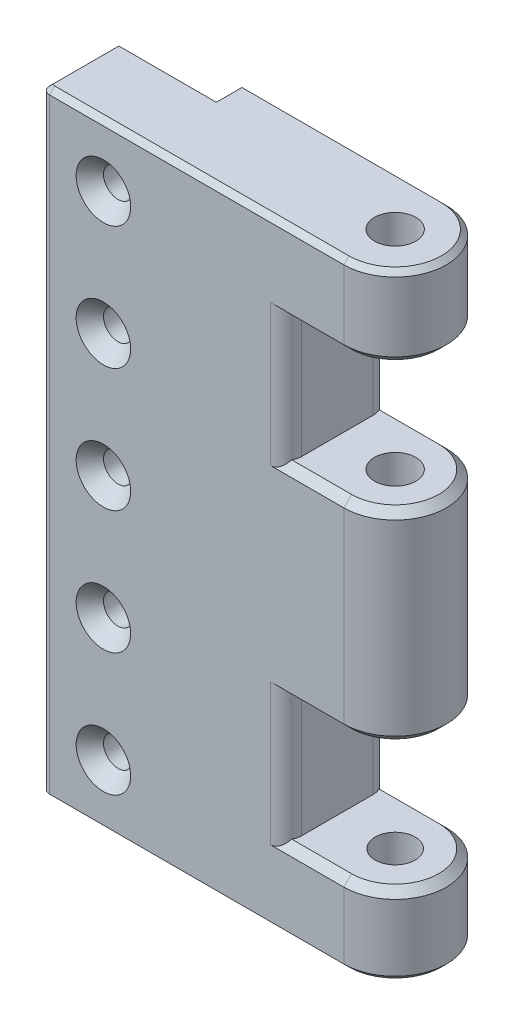
from build123d import *

# Parameters (mm, degrees)
BOSS_EXTRUDE1_DEPTH                            = 95.25
CSK_FOR_8_FLAT_HEAD_MACHINE_SCREW1_D           = 4.4958
CSK_FOR_8_FLAT_HEAD_MACHINE_SCREW1_CSINK_D     = 8.4328
CSK_FOR_8_FLAT_HEAD_MACHINE_SCREW1_CSINK_ANGLE = 82
SKETCH2_R                                      = 2.9464
CUT_EXTRUDE1_DEPTH                             = 105.057346731
MOVE_FACE1_BY                                  = 0.250000008
SKETCH6_W                                      = 15.875
SKETCH6_H                                      = 19.05
CUT_EXTRUDE2_DEPTH                             = 105.057346731
MOVE_FACE2_BY                                  = 0.399999962
MOVE_FACE2_2_BY                                = 0.399999962
MOVE_FACE3_BY                                  = 1.000000032
MOVE_FACE3_2_BY                                = 1.000000032
MOVE_FACE4_BY                                  = 0.100000054
FILLET1_R                                      = 1.199999886
FILLET2_R                                      = 2.400000026
CHAMFER1_SIZE                                  = 0.799999924
CHAMFER2_SIZE                                  = 1.199999886
CUT_EXTRUDE3_DEPTH                             = 0.799999924


with BuildPart() as part:
    # Sketch1 → Boss-Extrude1 (new body)
    with BuildSketch(Plane(origin=(0, 0, 0), x_dir=(1, 0, 0), z_dir=(0, 1, 0))):
        with BuildLine():
            Line((-15.875, -4.7625), (-15.875, -15.875))
            Line((-15.875, -15.875), (30.8356, -15.875))
            ThreePointArc((30.8356, -15.875), (38.7731, -7.9375), (30.8356, 0))
            Line((30.8356, 0), (0, 0))
            Line((0, 0), (0, -4.7625))
            Line((0, -4.7625), (-15.875, -4.7625))
        make_face()
    extrude(amount=BOSS_EXTRUDE1_DEPTH)

    # CSK for #8 Flat Head Machine Screw1 (through all)
    with Locations(Plane.XY.offset(15.875)):
        with Locations((-6.35, 85.725), (-6.35, 66.675), (-6.35, 47.625), (-6.35, 28.575), (-6.35, 9.525)):
            CounterSinkHole(CSK_FOR_8_FLAT_HEAD_MACHINE_SCREW1_D / 2, CSK_FOR_8_FLAT_HEAD_MACHINE_SCREW1_CSINK_D / 2, counter_sink_angle=CSK_FOR_8_FLAT_HEAD_MACHINE_SCREW1_CSINK_ANGLE)

    # Sketch2 → Cut-Extrude1 (cut, through all)
    with BuildSketch(Plane(origin=(0, 95.25, 0), x_dir=(1, 0, 0), z_dir=(0, 1, 0))):
        with Locations(Location((30.8356, -7.9375, 0), (0, 0, 270))):
            Circle(SKETCH2_R)
    extrude(amount=-CUT_EXTRUDE1_DEPTH, mode=Mode.SUBTRACT)

    # Move Face1: a curved face moved inward by 0.25
    add(Solid.thicken(part.faces().sort_by_distance((30.8356, 47.625, 4.9911))[0], -MOVE_FACE1_BY), mode=Mode.SUBTRACT)

    # Sketch6 → Cut-Extrude2 (cut, through all)
    with BuildSketch(Plane.XY.offset(15.875)):
        with Locations((30.8356, 73.025)):
            Rectangle(SKETCH6_W, SKETCH6_H)
        with Locations((30.8356, 22.225)):
            Rectangle(SKETCH6_W, SKETCH6_H)
    extrude(amount=-CUT_EXTRUDE2_DEPTH, mode=Mode.SUBTRACT)

    # Move Face2: a face moved inward by 0.4
    extrude(part.faces().sort_by_distance((30.8356, 12.7, 3.96875))[0], amount=MOVE_FACE2_BY, dir=(0, -1, 0), mode=Mode.SUBTRACT)

    # Move Face2 2: a face moved inward by 0.4
    extrude(part.faces().sort_by_distance((30.8356, 63.5, 3.96875))[0], amount=MOVE_FACE2_2_BY, dir=(0, -1, 0), mode=Mode.SUBTRACT)

    # Move Face3: a face moved inward by 1.0
    extrude(part.faces().sort_by_distance((22.8981, 72.825000019, 7.9375))[0], amount=MOVE_FACE3_BY, dir=(-1, 0, 0), mode=Mode.SUBTRACT)

    # Move Face3 2: a face moved inward by 1.0
    extrude(part.faces().sort_by_distance((22.8981, 22.025000019, 7.9375))[0], amount=MOVE_FACE3_2_BY, dir=(-1, 0, 0), mode=Mode.SUBTRACT)

    # Move Face4: a curved face moved outward by 0.1
    add(Solid.thicken(part.faces().sort_by_distance((30.8356, 6.150000019, 4.741099992))[0], MOVE_FACE4_BY))

    # Fillet1
    fillet1_edges = [part.edges().sort_by_distance(p)[0] for p in [
        (-15.875, 47.625, 15.875),
    ]]
    fillet(fillet1_edges, radius=FILLET1_R)

    # Fillet2
    fillet2_edges = [part.edges().sort_by_distance(p)[0] for p in [
        (21.898099968, 72.825000019, 0),
        (21.898099968, 72.825000019, 15.875),
        (21.898099968, 22.025000019, 0),
        (21.898099968, 22.025000019, 15.875),
    ]]
    fillet(fillet2_edges, radius=FILLET2_R)

    # Chamfer1
    chamfer1_edges = [part.edges().sort_by_distance(p)[0] for p in [
        (8.080299943, 95.25, 15.875),
        (8.080299943, 0, 15.875),
        (-15.523528171, 0, 15.523528171),
        (-15.523528171, 95.25, 15.523528171),
        (38.7731, 95.25, 7.9375),
        (15.4178, 95.25, 0),
        (15.4178, 0, 0),
        (38.7731, 0, 7.9375),
        (-15.875, 0, 9.718750057),
        (-15.875, 95.25, 9.718750057),
    ]]
    chamfer(chamfer1_edges, length=CHAMFER1_SIZE)

    # Chamfer2
    chamfer2_edges = [part.edges().sort_by_distance(p)[0] for p in [
        (38.7731, 82.55, 7.9375),
        (25.166849971, 82.55, 0),
        (25.166849971, 63.100000038, 0),
        (38.7731, 63.100000038, 7.9375),
        (25.166849971, 82.55, 15.875),
        (25.166849971, 63.100000038, 15.875),
        (38.7731, 31.75, 7.9375),
        (25.166849971, 31.75, 0),
        (25.166849971, 12.300000038, 0),
        (38.7731, 12.300000038, 7.9375),
        (25.166849971, 31.75, 15.875),
        (25.166849971, 12.300000038, 15.875),
    ]]
    chamfer(chamfer2_edges, length=CHAMFER2_SIZE)


with BuildPart() as body_2:
    # Mirror1: mirrored copy
    add(part.part.mirror(Plane(origin=(0, 0, 0), x_dir=(0, 0, 1), z_dir=(1, 0, 0))))


with BuildPart() as cut_extrude3_tool:
    # Sketch7 → Cut-Extrude3 (new body)
    # profile 1 of 2: a face of its own
    with BuildSketch(Plane(origin=(0, 0, 0), x_dir=(-1, 0, 0), z_dir=(0, 0, -1))):
        with BuildLine():
            Line((-20.412409211, 38.1), (-21.734237952, 38.1))
            Line((-21.734237952, 38.1), (-23.320432442, 40.743657484))
            add(Edge.make_bspline(
                [(-23.320432442, 40.743657484), (-23.39246628, 40.858422627), (-23.52796777, 41.074305166), (-23.74573892, 41.362084605), (-23.956458509, 41.605820363), (-24.178959725, 41.796609957), (-24.411259949, 41.945774465), (-24.66555501, 42.041863685), (-24.94306761, 42.100661436), (-25.137376333, 42.107127078), (-25.239531949, 42.110526316)],
                knots=[0, 0, 0, 0, 1.306497362, 2.457627467, 3.478958043, 4.407874435, 5.276294006, 6.127627337, 7.015621229, 8, 8, 8, 8], degree=3))
            Line((-25.239531949, 42.110526316), (-26.177540789, 42.110526316))
            Line((-26.177540789, 42.110526316), (-26.177540789, 38.1))
            Line((-26.177540789, 38.1), (-27.305501316, 38.1))
            Line((-27.305501316, 38.1), (-27.305501316, 47.625))
            Line((-27.305501316, 47.625), (-24.450351234, 47.625))
            add(Edge.make_bspline(
                [(-24.450351234, 47.625), (-24.347806001, 47.623129418), (-24.146199259, 47.619451803), (-23.849497415, 47.590158509), (-23.565748079, 47.538652332), (-23.294428494, 47.470652115), (-23.037326038, 47.383677735), (-22.797710845, 47.273159326), (-22.57435286, 47.144015465), (-22.370417771, 46.991886303), (-22.183160925, 46.822598362), (-22.019334584, 46.629590128), (-21.876320998, 46.418408005), (-21.756058405, 46.187155813), (-21.659502559, 45.936474231), (-21.588740249, 45.664775603), (-21.547846501, 45.371631063), (-21.542908146, 45.169465091), (-21.540369737, 45.065547903)],
                knots=[0, 0, 0, 0, 1.122660118, 2.207180616, 3.260035189, 4.277559223, 5.267526261, 6.226939943, 7.162224589, 8.087074141, 9.00774428, 9.920166118, 10.85183919, 11.794874382, 12.767769948, 13.787074559, 14.862513871, 16, 16, 16, 16], degree=3))
            add(Edge.make_bspline(
                [(-21.540369737, 45.065547903), (-21.542357217, 44.983878967), (-21.546264084, 44.823339156), (-21.57390063, 44.587383869), (-21.620526513, 44.361103987), (-21.687741358, 44.145993266), (-21.769898701, 43.941469561), (-21.868344577, 43.74780219), (-21.984139869, 43.565845661), (-22.115072733, 43.395259432), (-22.261958201, 43.238149058), (-22.419872875, 43.089916318), (-22.595585255, 42.957356067), (-22.784024282, 42.835490164), (-22.985181681, 42.726560713), (-23.198195231, 42.629572918), (-23.423773409, 42.547595818), (-23.579934628, 42.503184465), (-23.659212253, 42.480638363)],
                knots=[0, 0, 0, 0, 1.081472828, 2.125893282, 3.141472299, 4.136796786, 5.106410527, 6.057503338, 7.009617098, 7.958900923, 8.9009934, 9.855302418, 10.823566394, 11.811505165, 12.825021642, 13.850268175, 14.908655843, 16, 16, 16, 16], degree=3))
            Line((-23.659212253, 42.480638363), (-23.659212253, 42.453222656))
            add(Edge.make_bspline(
                [(-23.659212253, 42.453222656), (-23.580440976, 42.417398664), (-23.430201665, 42.349072086), (-23.227647339, 42.216467885), (-23.043792737, 42.06881687), (-22.876744064, 41.892393409), (-22.707999377, 41.696943007), (-22.5465086, 41.468307362), (-22.37186832, 41.212866322), (-22.253430103, 41.030490431), (-22.190513651, 40.933609169)],
                knots=[0, 0, 0, 0, 0.964360555, 1.839310864, 2.693732611, 3.590073818, 4.546144586, 5.573387662, 6.710941094, 8, 8, 8, 8], degree=3))
            Line((-22.190513651, 40.933609169), (-20.412409211, 38.1))
        make_face()
        with BuildLine():
            Line((-26.177540789, 46.622368421), (-26.177540789, 43.113157895))
            Line((-26.177540789, 43.113157895), (-24.638344655, 43.113157895))
            add(Edge.make_bspline(
                [(-24.638344655, 43.113157895), (-24.569102811, 43.114710218), (-24.432171893, 43.117780052), (-24.230682013, 43.140672174), (-24.038064572, 43.183371896), (-23.852785081, 43.236317079), (-23.679677481, 43.310303445), (-23.515001668, 43.393491968), (-23.365110484, 43.494164986), (-23.225565012, 43.605761469), (-23.10263029, 43.734919697), (-22.990088563, 43.874377459), (-22.896446885, 44.030414223), (-22.812645632, 44.196203849), (-22.749245008, 44.376780257), (-22.701600246, 44.56741074), (-22.674241595, 44.768408501), (-22.670326553, 44.905542676), (-22.668330263, 44.975467722)],
                knots=[0, 0, 0, 0, 1.090010243, 2.155576699, 3.185466336, 4.1933334, 5.183762916, 6.144316812, 7.093369302, 8.020984545, 8.951157476, 9.894798401, 10.83591824, 11.810170468, 12.814521676, 13.841330878, 14.899289422, 16, 16, 16, 16], degree=3))
            add(Edge.make_bspline(
                [(-22.668330263, 44.975467722), (-22.669755188, 45.038210828), (-22.672541335, 45.160892047), (-22.696634379, 45.339904799), (-22.73515642, 45.508714327), (-22.790191358, 45.666401453), (-22.860981229, 45.813536083), (-22.950346987, 45.948264178), (-23.05196724, 46.074873626), (-23.170530652, 46.18917611), (-23.304284867, 46.289915007), (-23.449590319, 46.382158658), (-23.611610469, 46.455601424), (-23.787524875, 46.51610884), (-23.976521707, 46.565569479), (-24.180601911, 46.597218806), (-24.397597512, 46.620398699), (-24.547543149, 46.62169958), (-24.624636801, 46.622368421)],
                knots=[0, 0, 0, 0, 1.036630811, 2.02691802, 2.979521427, 3.89397019, 4.781810153, 5.670567375, 6.560240909, 7.460578941, 8.384147086, 9.324204361, 10.29927051, 11.31606129, 12.396781476, 13.52306989, 14.726501219, 16, 16, 16, 16], degree=3))
            Line((-24.624636801, 46.622368421), (-26.177540789, 46.622368421))
        make_face(mode=Mode.SUBTRACT)
    # profile 2 of 2: a face of its own
    with BuildSketch(Plane(origin=(0, 0, 0), x_dir=(-1, 0, 0), z_dir=(0, 0, -1))):
        Polygon((27.430830263, 38.1), (22.543001316, 38.1), (22.543001316, 47.625), (23.670961842, 47.625), (23.670961842, 39.102631579), (27.430830263, 39.102631579), align=None)
    extrude(amount=-CUT_EXTRUDE3_DEPTH)


with BuildPart() as part_1:
    add(part.part)

    # Cut-Extrude3: cut by cut_extrude3_tool
    add(cut_extrude3_tool.part, mode=Mode.SUBTRACT)


with BuildPart() as body_2_1:
    add(body_2.part)

    # Cut-Extrude3: cut by cut_extrude3_tool
    add(cut_extrude3_tool.part, mode=Mode.SUBTRACT)


solid = part_1.part
